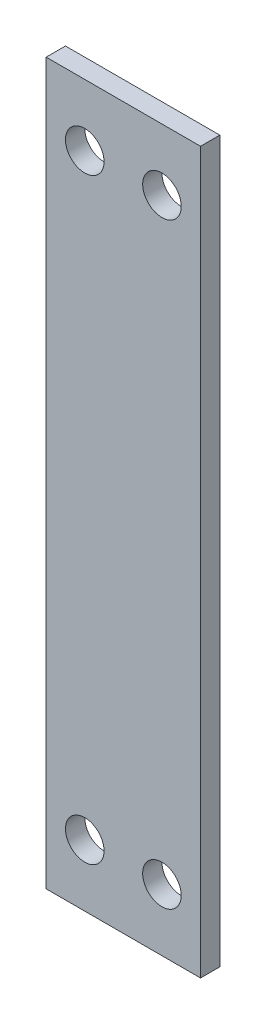
from build123d import *

# Parameters (mm, degrees)
SKETCH1_W           = 38.1
SKETCH1_H           = 177.8
SKETCH1_R           = 4.7625
BOSS_EXTRUDE1_DEPTH = 4.7625


with BuildPart() as part:
    # Sketch1 → Boss-Extrude1 (new body)
    with BuildSketch(Plane.XY):
        with Locations((19.05, 88.9)):
            Rectangle(SKETCH1_W, SKETCH1_H)
        with Locations(Location((9.525, 15.24, 0), (0, 0, 180))):
            Circle(SKETCH1_R, mode=Mode.SUBTRACT)
        with Locations(Location((28.575, 15.24, 0), (0, 0, 180))):
            Circle(SKETCH1_R, mode=Mode.SUBTRACT)
        with Locations(Location((9.525, 162.56, 0), (0, 0, 180))):
            Circle(SKETCH1_R, mode=Mode.SUBTRACT)
        with Locations(Location((28.575, 162.56, 0), (0, 0, 180))):
            Circle(SKETCH1_R, mode=Mode.SUBTRACT)
    extrude(amount=BOSS_EXTRUDE1_DEPTH)


solid = part.part
